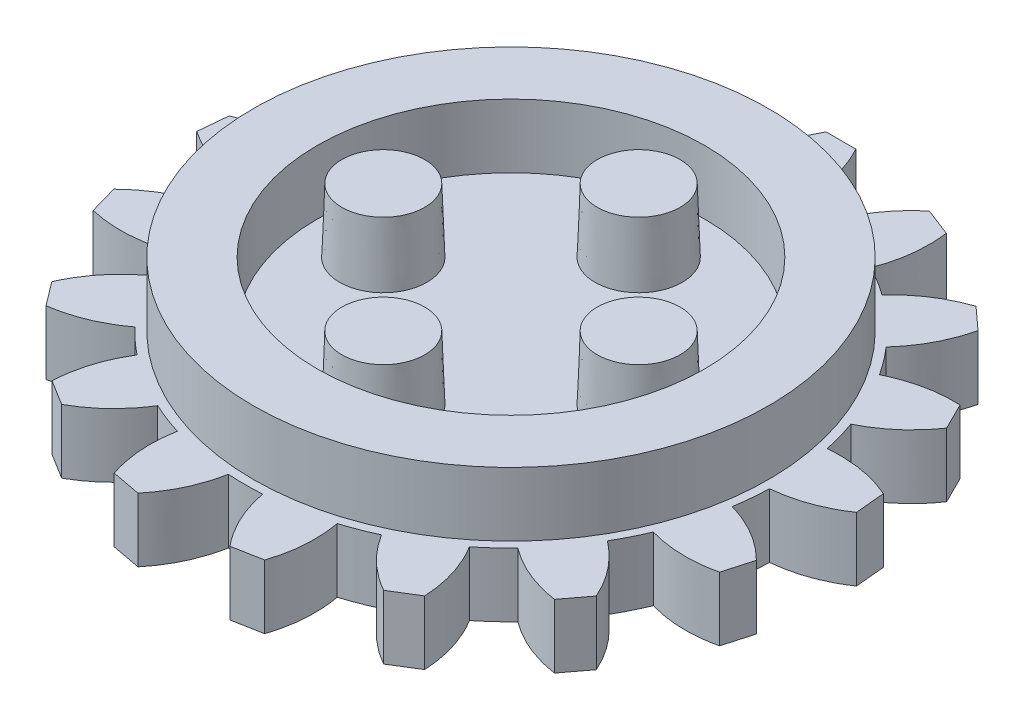
from build123d import *

# Parameters (mm, degrees)
SKETCH2_R                     = 8.9
BOSS_EXTRUDE1_DEPTH           = 1.5
SKETCH3_R                     = 12.1
SKETCH3_R_2                   = 9.1
BOSS_EXTRUDE2_DEPTH           = 3
SKETCH4_R                     = 8.9
BOSS_EXTRUDE3_DEPTH           = 3
SKETCH5_R                     = 2.05
BOSS_EXTRUDE4_DEPTH           = 3
BOSS_EXTRUDE4_DRAFT           = 2
BOSS_EXTRUDE4_PROFILE_2_DEPTH = 3
BOSS_EXTRUDE4_PROFILE_2_DRAFT = 2
BOSS_EXTRUDE4_PROFILE_3_DEPTH = 3
BOSS_EXTRUDE4_PROFILE_3_DRAFT = 2
BOSS_EXTRUDE4_PROFILE_4_DEPTH = 3
BOSS_EXTRUDE4_PROFILE_4_DRAFT = 2


with BuildPart() as part:
    # Sketch2 → Boss-Extrude1 (new, symmetric)
    with BuildSketch(Plane(origin=(0, 0, 0), x_dir=(1, 0, 0), z_dir=(0, 1, 0))):
        with BuildLine():
            Line((-0.7, 15.5), (0.7, 15.5))
            add(Edge.make_bspline(
                [(0.7, 15.5), (1.496850228, 14.057355909), (1.5, 12.409673646)],
                knots=[0, 0, 0, 1, 1, 1], degree=2))
            ThreePointArc((1.5, 12.409673646), (2.296868973, 12.287163746), (3.084182841, 12.11353855))
            add(Edge.make_bspline(
                [(4.946515265, 14.706188722), (3.682331401, 13.648818674), (3.084182841, 12.11353855)],
                knots=[0, 0, 0, 1, 1, 1], degree=2))
            Line((4.946515265, 14.706188722), (6.251976386, 14.200450389))
            add(Edge.make_bspline(
                [(6.251976386, 14.200450389), (6.47387394, 12.567369333), (5.881599529, 11.029813552)],
                knots=[0, 0, 0, 1, 1, 1], degree=2))
            ThreePointArc((5.881599529, 11.029813552), (6.580402036, 10.627714197), (7.251829699, 10.18140295))
            add(Edge.make_bspline(
                [(9.924976234, 11.926225167), (8.364193771, 11.396932847), (7.251829699, 10.18140295)],
                knots=[0, 0, 0, 1, 1, 1], degree=2))
            Line((9.924976234, 11.926225167), (10.959588719, 10.983051266))
            add(Edge.make_bspline(
                [(10.959588719, 10.983051266), (10.576565103, 9.380089891), (9.46885645, 8.160316019)],
                knots=[0, 0, 0, 1, 1, 1], degree=2))
            ThreePointArc((9.46885645, 8.160316019), (9.975215341, 7.532932955), (10.440076772, 6.874212464))
            add(Edge.make_bspline(
                [(13.563014167, 7.535558818), (11.916425423, 7.605828086), (10.440076772, 6.874212464)],
                knots=[0, 0, 0, 1, 1, 1], degree=2))
            Line((13.563014167, 7.535558818), (14.187047865, 6.282330211))
            add(Edge.make_bspline(
                [(14.187047865, 6.282330211), (13.250832542, 4.925977332), (11.777291839, 4.18872259)],
                knots=[0, 0, 0, 1, 1, 1], degree=2))
            ThreePointArc((11.777291839, 4.18872259), (12.02282054, 3.420787376), (12.218333627, 2.638621493))
            add(Edge.make_bspline(
                [(15.369291881, 2.127173495), (13.859277792, 2.787514097), (12.218333627, 2.638621493)],
                knots=[0, 0, 0, 1, 1, 1], degree=2))
            Line((15.369291881, 2.127173495), (15.498467584, 0.733145648))
            add(Edge.make_bspline(
                [(15.498467584, 0.733145648), (14.135501622, -0.193415761), (12.495138705, -0.348581036)],
                knots=[0, 0, 0, 1, 1, 1], degree=2))
            ThreePointArc((12.495138705, -0.348581036), (12.446677204, -1.153354493), (12.346436821, -1.953329931))
            add(Edge.make_bspline(
                [(15.099861562, -3.568498396), (13.930357897, -2.407269117), (12.346436821, -1.953329931)],
                knots=[0, 0, 0, 1, 1, 1], degree=2))
            Line((15.099861562, -3.568498396), (14.716733376, -4.915054296))
            add(Edge.make_bspline(
                [(14.716733376, -4.915054296), (13.111092879, -5.286686984), (11.525447851, -4.838806861)],
                knots=[0, 0, 0, 1, 1, 1], degree=2))
            ThreePointArc((11.525447851, -4.838806861), (11.189541142, -5.571729447), (10.807085309, -6.281473324))
            add(Edge.make_bspline(
                [(12.791111268, -8.782224805), (12.120065978, -7.276937298), (10.807085309, -6.281473324)],
                knots=[0, 0, 0, 1, 1, 1], degree=2))
            Line((12.791111268, -8.782224805), (11.947422777, -9.899448923))
            add(Edge.make_bspline(
                [(11.947422777, -9.899448923), (10.315958392, -9.665961835), (8.9991814, -8.675525006)],
                knots=[0, 0, 0, 1, 1, 1], degree=2))
            ThreePointArc((8.9991814, -8.675525006), (8.421195546, -9.237611465), (7.808177042, -9.761268938))
            add(Edge.make_bspline(
                [(8.75485052, -12.80986309), (8.672891989, -11.163814774), (7.808177042, -9.761268938)],
                knots=[0, 0, 0, 1, 1, 1], degree=2))
            Line((8.75485052, -12.80986309), (7.56454653, -13.546868118))
            add(Edge.make_bspline(
                [(7.56454653, -13.546868118), (6.127596562, -12.73979498), (5.257525634, -11.340565427)],
                knots=[0, 0, 0, 1, 1, 1], degree=2))
            ThreePointArc((5.257525634, -11.340565427), (4.515520827, -11.655902868), (3.754731198, -11.922751093))
            add(Edge.make_bspline(
                [(3.536198696, -15.107458383), (4.054395878, -13.542957203), (3.754731198, -11.922751093)],
                knots=[0, 0, 0, 1, 1, 1], degree=2))
            Line((3.536198696, -15.107458383), (2.160036356, -15.364707708))
            add(Edge.make_bspline(
                [(2.160036356, -15.364707708), (1.111668862, -14.093048219), (0.805811899, -12.473999647)],
                knots=[0, 0, 0, 1, 1, 1], degree=2))
            ThreePointArc((0.805811899, -12.473999647), (0, -12.5), (-0.805811899, -12.473999647))
            add(Edge.make_bspline(
                [(-2.160036356, -15.364707708), (-1.111668862, -14.093048219), (-0.805811899, -12.473999647)],
                knots=[0, 0, 0, 1, 1, 1], degree=2))
            Line((-2.160036356, -15.364707708), (-3.536198696, -15.107458383))
            add(Edge.make_bspline(
                [(-3.536198696, -15.107458383), (-4.054395878, -13.542957203), (-3.754731198, -11.922751093)],
                knots=[0, 0, 0, 1, 1, 1], degree=2))
            ThreePointArc((-3.754731198, -11.922751093), (-4.515520827, -11.655902868), (-5.257525634, -11.340565427))
            add(Edge.make_bspline(
                [(-7.56454653, -13.546868118), (-6.127596562, -12.73979498), (-5.257525634, -11.340565427)],
                knots=[0, 0, 0, 1, 1, 1], degree=2))
            Line((-7.56454653, -13.546868118), (-8.75485052, -12.80986309))
            add(Edge.make_bspline(
                [(-8.75485052, -12.80986309), (-8.672891989, -11.163814774), (-7.808177042, -9.761268938)],
                knots=[0, 0, 0, 1, 1, 1], degree=2))
            ThreePointArc((-7.808177042, -9.761268938), (-8.421195546, -9.237611465), (-8.9991814, -8.675525006))
            add(Edge.make_bspline(
                [(-11.947422777, -9.899448923), (-10.315958392, -9.665961835), (-8.9991814, -8.675525006)],
                knots=[0, 0, 0, 1, 1, 1], degree=2))
            Line((-11.947422777, -9.899448923), (-12.791111268, -8.782224805))
            add(Edge.make_bspline(
                [(-12.791111268, -8.782224805), (-12.120065978, -7.276937298), (-10.807085309, -6.281473324)],
                knots=[0, 0, 0, 1, 1, 1], degree=2))
            ThreePointArc((-10.807085309, -6.281473324), (-11.189541142, -5.571729447), (-11.525447851, -4.838806861))
            add(Edge.make_bspline(
                [(-14.716733376, -4.915054296), (-13.111092879, -5.286686984), (-11.525447851, -4.838806861)],
                knots=[0, 0, 0, 1, 1, 1], degree=2))
            Line((-14.716733376, -4.915054296), (-15.099861562, -3.568498396))
            add(Edge.make_bspline(
                [(-15.099861562, -3.568498396), (-13.930357897, -2.407269117), (-12.346436821, -1.953329931)],
                knots=[0, 0, 0, 1, 1, 1], degree=2))
            ThreePointArc((-12.346436821, -1.953329931), (-12.446677204, -1.153354493), (-12.495138705, -0.348581036))
            add(Edge.make_bspline(
                [(-15.498467584, 0.733145648), (-14.135501622, -0.193415761), (-12.495138705, -0.348581036)],
                knots=[0, 0, 0, 1, 1, 1], degree=2))
            Line((-15.498467584, 0.733145648), (-15.369291881, 2.127173495))
            add(Edge.make_bspline(
                [(-15.369291881, 2.127173495), (-13.859277792, 2.787514097), (-12.218333627, 2.638621493)],
                knots=[0, 0, 0, 1, 1, 1], degree=2))
            ThreePointArc((-12.218333627, 2.638621493), (-12.02282054, 3.420787376), (-11.777291839, 4.18872259))
            add(Edge.make_bspline(
                [(-14.187047865, 6.282330211), (-13.250832542, 4.925977332), (-11.777291839, 4.18872259)],
                knots=[0, 0, 0, 1, 1, 1], degree=2))
            Line((-14.187047865, 6.282330211), (-13.563014167, 7.535558818))
            add(Edge.make_bspline(
                [(-13.563014167, 7.535558818), (-11.916425423, 7.605828086), (-10.440076772, 6.874212464)],
                knots=[0, 0, 0, 1, 1, 1], degree=2))
            ThreePointArc((-10.440076772, 6.874212464), (-9.975215341, 7.532932955), (-9.46885645, 8.160316019))
            add(Edge.make_bspline(
                [(-10.959588719, 10.983051266), (-10.576565103, 9.380089891), (-9.46885645, 8.160316019)],
                knots=[0, 0, 0, 1, 1, 1], degree=2))
            Line((-10.959588719, 10.983051266), (-9.924976234, 11.926225167))
            add(Edge.make_bspline(
                [(-9.924976234, 11.926225167), (-8.364193771, 11.396932847), (-7.251829699, 10.18140295)],
                knots=[0, 0, 0, 1, 1, 1], degree=2))
            ThreePointArc((-7.251829699, 10.18140295), (-6.580402036, 10.627714197), (-5.881599529, 11.029813552))
            add(Edge.make_bspline(
                [(-6.251976386, 14.200450389), (-6.47387394, 12.567369333), (-5.881599529, 11.029813552)],
                knots=[0, 0, 0, 1, 1, 1], degree=2))
            Line((-6.251976386, 14.200450389), (-4.946515265, 14.706188722))
            add(Edge.make_bspline(
                [(-4.946515265, 14.706188722), (-3.682331401, 13.648818674), (-3.084182841, 12.11353855)],
                knots=[0, 0, 0, 1, 1, 1], degree=2))
            ThreePointArc((-3.084182841, 12.11353855), (-2.296868973, 12.287163746), (-1.5, 12.409673646))
            add(Edge.make_bspline(
                [(-0.7, 15.5), (-1.496850228, 14.057355909), (-1.5, 12.409673646)],
                knots=[0, 0, 0, 1, 1, 1], degree=2))
        make_face()
        with Locations(Location((0, 0, 0), (0, 0, 270))):
            Circle(SKETCH2_R, mode=Mode.SUBTRACT)
    extrude(amount=BOSS_EXTRUDE1_DEPTH, both=True)

    # Sketch3 → Boss-Extrude2 (add)
    with BuildSketch(Plane(origin=(0, 1.5, 0), x_dir=(1, 0, 0), z_dir=(0, 1, 0))):
        with Locations(Location((0, 0, 0), (0, 0, 270))):
            Circle(SKETCH3_R)
        with Locations(Location((0, 0, 0), (0, 0, 270))):
            Circle(SKETCH3_R_2, mode=Mode.SUBTRACT)
    extrude(amount=BOSS_EXTRUDE2_DEPTH)

    # Sketch4 → Boss-Extrude3 (add)
    with BuildSketch(Plane.XZ.offset(1.5)):
        Circle(SKETCH4_R)
    extrude(amount=-BOSS_EXTRUDE3_DEPTH)


with BuildPart() as boss_extrude4_tool:
    # Sketch5 → Boss-Extrude4 (with draft: the straight prism first)
    with BuildSketch(Plane(origin=(0, 1.5, 0), x_dir=(1, 0, 0), z_dir=(0, 1, 0))):
        with Locations((-6, 0)):
            Circle(SKETCH5_R)
    extrude(amount=BOSS_EXTRUDE4_DEPTH)
    # Boss-Extrude4: the draft: its side faces are tilted about the plane it starts from
    boss_extrude4_sides = [boss_extrude4_tool.faces().sort_by_distance(p)[0] for p in [
        (-8.05, 3, 0),
    ]]
    draft(boss_extrude4_sides, Plane(origin=(0, 1.5, 0), x_dir=(1, 0, 0), z_dir=(0, 1, 0)), BOSS_EXTRUDE4_DRAFT)


with BuildPart() as part_1:
    add(part.part)

    # Boss-Extrude4: add boss_extrude4_tool
    add(boss_extrude4_tool.part)


with BuildPart() as boss_extrude4_profile_2_tool:
    # Sketch5 → Boss-Extrude4 profile 2 (with draft: the straight prism first)
    with BuildSketch(Plane(origin=(0, 1.5, 0), x_dir=(1, 0, 0), z_dir=(0, 1, 0))):
        with Locations((6, 0)):
            Circle(SKETCH5_R)
    extrude(amount=BOSS_EXTRUDE4_PROFILE_2_DEPTH)
    # Boss-Extrude4 profile 2: the draft: its side faces are tilted about the plane it starts from
    boss_extrude4_profile_2_sides = [boss_extrude4_profile_2_tool.faces().sort_by_distance(p)[0] for p in [
        (3.95, 3, 0),
    ]]
    draft(boss_extrude4_profile_2_sides, Plane(origin=(0, 1.5, 0), x_dir=(1, 0, 0), z_dir=(0, 1, 0)), BOSS_EXTRUDE4_PROFILE_2_DRAFT)


with BuildPart() as part_2:
    add(part_1.part)

    # Boss-Extrude4 profile 2: add boss_extrude4_profile_2_tool
    add(boss_extrude4_profile_2_tool.part)


with BuildPart() as boss_extrude4_profile_3_tool:
    # Sketch5 → Boss-Extrude4 profile 3 (with draft: the straight prism first)
    with BuildSketch(Plane(origin=(0, 1.5, 0), x_dir=(1, 0, 0), z_dir=(0, 1, 0))):
        with Locations((0, -6)):
            Circle(SKETCH5_R)
    extrude(amount=BOSS_EXTRUDE4_PROFILE_3_DEPTH)
    # Boss-Extrude4 profile 3: the draft: its side faces are tilted about the plane it starts from
    boss_extrude4_profile_3_sides = [boss_extrude4_profile_3_tool.faces().sort_by_distance(p)[0] for p in [
        (-2.05, 3, 6),
    ]]
    draft(boss_extrude4_profile_3_sides, Plane(origin=(0, 1.5, 0), x_dir=(1, 0, 0), z_dir=(0, 1, 0)), BOSS_EXTRUDE4_PROFILE_3_DRAFT)


with BuildPart() as part_3:
    add(part_2.part)

    # Boss-Extrude4 profile 3: add boss_extrude4_profile_3_tool
    add(boss_extrude4_profile_3_tool.part)


with BuildPart() as boss_extrude4_profile_4_tool:
    # Sketch5 → Boss-Extrude4 profile 4 (with draft: the straight prism first)
    with BuildSketch(Plane(origin=(0, 1.5, 0), x_dir=(1, 0, 0), z_dir=(0, 1, 0))):
        with Locations((0, 6)):
            Circle(SKETCH5_R)
    extrude(amount=BOSS_EXTRUDE4_PROFILE_4_DEPTH)
    # Boss-Extrude4 profile 4: the draft: its side faces are tilted about the plane it starts from
    boss_extrude4_profile_4_sides = [boss_extrude4_profile_4_tool.faces().sort_by_distance(p)[0] for p in [
        (-2.05, 3, -6),
    ]]
    draft(boss_extrude4_profile_4_sides, Plane(origin=(0, 1.5, 0), x_dir=(1, 0, 0), z_dir=(0, 1, 0)), BOSS_EXTRUDE4_PROFILE_4_DRAFT)


with BuildPart() as part_4:
    add(part_3.part)

    # Boss-Extrude4 profile 4: add boss_extrude4_profile_4_tool
    add(boss_extrude4_profile_4_tool.part)


solid = part_4.part
